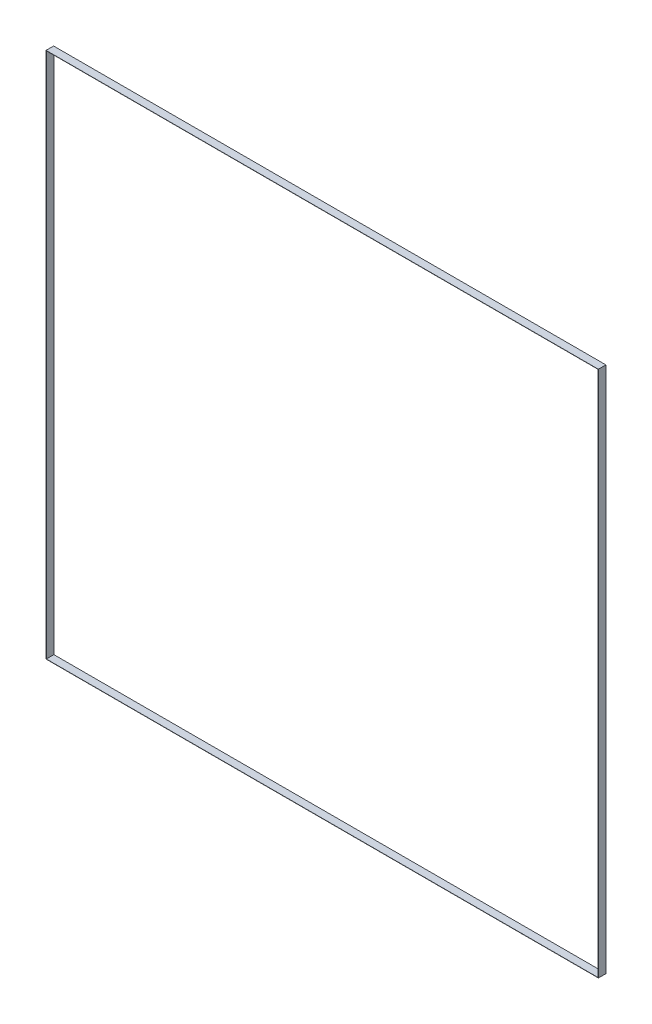
from build123d import *

# Parameters (mm, degrees)
SKETCH1_W           = 22
SKETCH1_H           = 21
SKETCH1_W_2         = 21.98
SKETCH1_H_2         = 20.98
BOSS_EXTRUDE1_DEPTH = 0.15


with BuildPart() as part:
    # Sketch1 → Boss-Extrude1 (new, symmetric)
    with BuildSketch(Plane.XY):
        with Locations((-11, 10.5)):
            Rectangle(SKETCH1_W, SKETCH1_H)
        with Locations((-11, 10.5)):
            Rectangle(SKETCH1_W_2, SKETCH1_H_2, mode=Mode.SUBTRACT)
    extrude(amount=BOSS_EXTRUDE1_DEPTH, both=True)


solid = part.part
